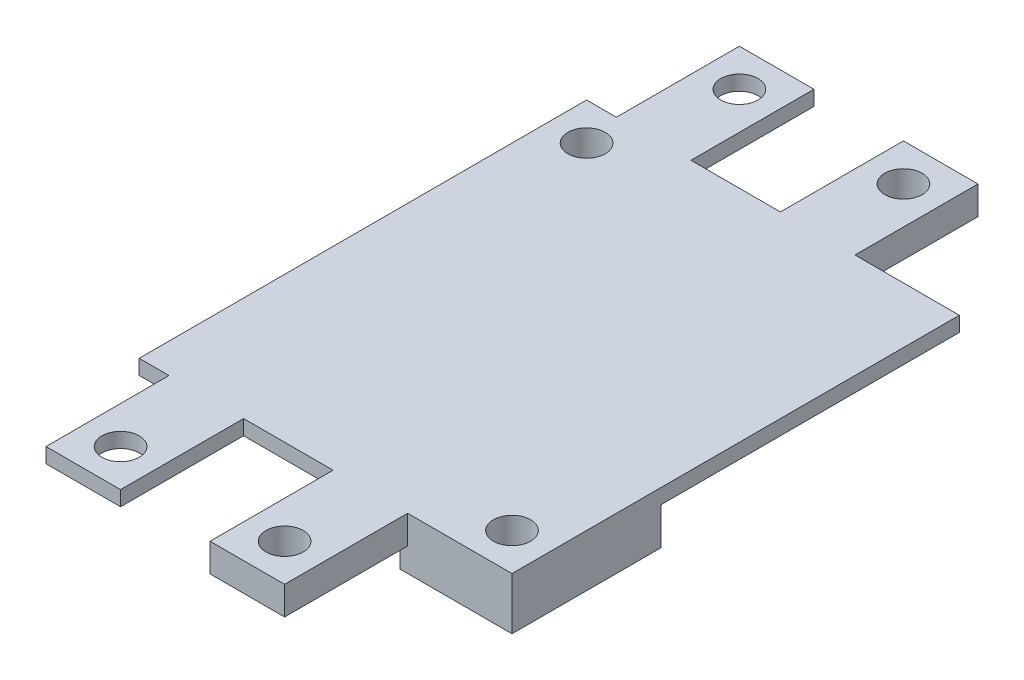
from build123d import *

# Parameters (mm, degrees)
SKETCH1_W           = 50
SKETCH1_H           = 60
BOSS_EXTRUDE1_DEPTH = 2
SKETCH2_W           = 15
SKETCH2_H           = 20
SKETCH2_H_2         = 14
BOSS_EXTRUDE2_DEPTH = 5
SKETCH3_R           = 2.5
CUT_EXTRUDE1_DEPTH  = 7
SKETCH4_W           = 10
SKETCH4_H           = 16.5
SKETCH4_R           = 2.5
BOSS_EXTRUDE3_DEPTH = 2
SKETCH5_W           = 10
SKETCH5_H           = 16.5
SKETCH5_R           = 2.5
BOSS_EXTRUDE5_DEPTH = 3.8


with BuildPart() as part:
    # Sketch1 → Boss-Extrude1 (new body)
    with BuildSketch(Plane(origin=(0, 0, 0), x_dir=(1, 0, 0), z_dir=(0, 1, 0))):
        with Locations((25, 30)):
            Rectangle(SKETCH1_W, SKETCH1_H)
    extrude(amount=BOSS_EXTRUDE1_DEPTH)

    # Sketch2 → Boss-Extrude2 (add)
    with BuildSketch(Plane.XZ):
        with Locations((42.5, -10)):
            Rectangle(SKETCH2_W, SKETCH2_H)
        with Locations((7.5, -53)):
            Rectangle(SKETCH2_W, SKETCH2_H_2)
    extrude(amount=BOSS_EXTRUDE2_DEPTH)

    # Sketch3 → Cut-Extrude1 (cut)
    with BuildSketch(Plane(origin=(0, 2, 0), x_dir=(1, 0, 0), z_dir=(0, 1, 0))):
        with Locations(Location((45, 5, 0), (0, 0, 270))):
            Circle(SKETCH3_R)
        with Locations(Location((5, 55, 0), (0, 0, 270))):
            Circle(SKETCH3_R)
    extrude(amount=-CUT_EXTRUDE1_DEPTH, mode=Mode.SUBTRACT)

    # Sketch4 → Boss-Extrude3 (add)
    # profile 1 of 2: a face of its own
    with BuildSketch(Plane(origin=(0, 2, 0), x_dir=(1, 0, 0), z_dir=(0, 1, 0))):
        with Locations((9, 68.25)):
            Rectangle(SKETCH4_W, SKETCH4_H)
        with Locations(Location((9, 71.5, 0), (0, 0, 270))):
            Circle(SKETCH4_R, mode=Mode.SUBTRACT)
    # profile 2 of 2: a face of its own
    with BuildSketch(Plane(origin=(0, 2, 0), x_dir=(1, 0, 0), z_dir=(0, 1, 0))):
        with Locations((9, -8.25)):
            Rectangle(SKETCH4_W, SKETCH4_H)
        with Locations(Location((9, -11.5, 0), (0, 0, 270))):
            Circle(SKETCH4_R, mode=Mode.SUBTRACT)
    extrude(amount=-BOSS_EXTRUDE3_DEPTH)

    # Sketch5 → Boss-Extrude5 (add)
    # profile 1 of 2: a face of its own
    with BuildSketch(Plane(origin=(0, 2, 0), x_dir=(1, 0, 0), z_dir=(0, 1, 0))):
        with Locations((31, 68.25)):
            Rectangle(SKETCH5_W, SKETCH5_H)
        with Locations(Location((31, 71.5, 0), (0, 0, 270))):
            Circle(SKETCH5_R, mode=Mode.SUBTRACT)
    # profile 2 of 2: a face of its own
    with BuildSketch(Plane(origin=(0, 2, 0), x_dir=(1, 0, 0), z_dir=(0, 1, 0))):
        with Locations((31, -8.25)):
            Rectangle(SKETCH5_W, SKETCH5_H)
        with Locations(Location((31, -11.5, 0), (0, 0, 270))):
            Circle(SKETCH5_R, mode=Mode.SUBTRACT)
    extrude(amount=-BOSS_EXTRUDE5_DEPTH)


solid = part.part
